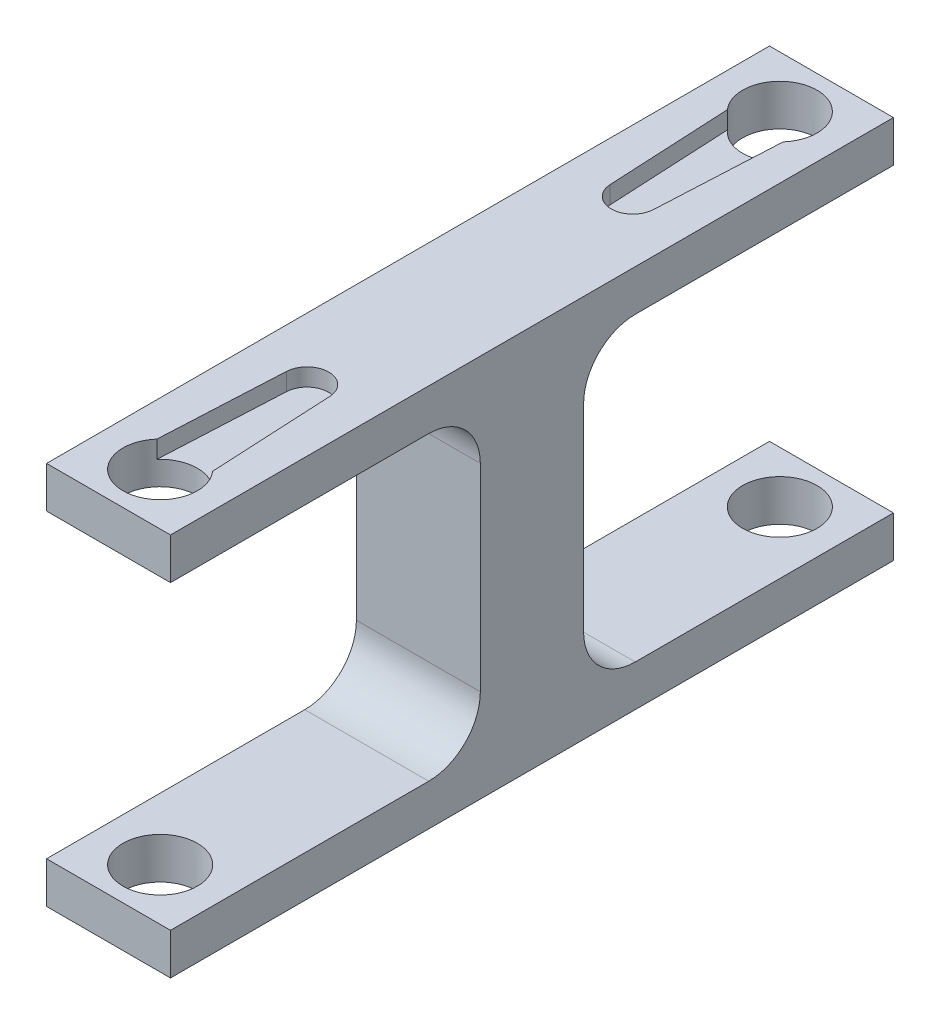
from build123d import *

# Parameters (mm, degrees)
SKETCH2_W            = 12
SKETCH2_H            = 37.15
BOSS_EXTRUDE2_DEPTH  = 2.5
SKETCH11_W           = 12
SKETCH11_H           = 4
BOSS_EXTRUDE8_DEPTH  = 30
CUT_EXTRUDE1_DEPTH   = 1.7
SKETCH14_W           = 12
SKETCH14_H           = 37.15
BOSS_EXTRUDE9_DEPTH  = 7.5
SKETCH16_W           = 12
SKETCH16_H           = 4
BOSS_EXTRUDE11_DEPTH = 30
CUT_EXTRUDE4_DEPTH   = 1.7
SKETCH22_R           = 3.6
CUT_EXTRUDE6_DEPTH   = 54.483943136
SKETCH23_R           = 3.6
CUT_EXTRUDE7_DEPTH   = 54.483943136
FILLET1_R            = 5
FILLET2_R            = 5
FILLET3_R            = 5
FILLET4_R            = 5


with BuildPart() as part:
    # Sketch2 → Boss-Extrude2 (new body)
    with BuildSketch(Plane.XY):
        with Locations((-2.61160109, -17.608451256)):
            Rectangle(SKETCH2_W, SKETCH2_H)
    extrude(amount=BOSS_EXTRUDE2_DEPTH)

    # Sketch11 → Boss-Extrude8 (add)
    with BuildSketch(Plane.XY.offset(2.5)):
        with Locations((-2.61160109, -1.033451256)):
            Rectangle(SKETCH11_W, SKETCH11_H)
        with Locations((-2.61160109, -34.183451256)):
            Rectangle(SKETCH11_W, SKETCH11_H)
    extrude(amount=BOSS_EXTRUDE8_DEPTH)

    # Sketch12 → Cut-Extrude1 (cut)
    with BuildSketch(Plane(origin=(0, 0.966548744, 0), x_dir=(1, 0, 0), z_dir=(0, 1, 0))):
        with BuildLine():
            Line((-0.514266567, -13.168774056), (0.08839891, -25.11882382))
            ThreePointArc((0.08839891, -25.11882382), (-2.61160109, -31.1), (-5.31160109, -25.11882382))
            Line((-5.31160109, -25.11882382), (-4.708935612, -13.168774056))
            ThreePointArc((-4.708935612, -13.168774056), (-2.61160109, -11.174546931), (-0.514266567, -13.168774056))
        make_face()
    extrude(amount=-CUT_EXTRUDE1_DEPTH, mode=Mode.SUBTRACT)

    # Sketch14 → Boss-Extrude9 (add)
    with BuildSketch(Plane(origin=(0, 0, 0), x_dir=(-1, 0, 0), z_dir=(0, 0, -1))):
        with Locations((2.61160109, -17.608451256)):
            Rectangle(SKETCH14_W, SKETCH14_H)
    extrude(amount=BOSS_EXTRUDE9_DEPTH)

    # Sketch16 → Boss-Extrude11 (add)
    with BuildSketch(Plane(origin=(0, 0, -7.5), x_dir=(-1, 0, 0), z_dir=(0, 0, -1))):
        with Locations((2.61160109, -1.033451256)):
            Rectangle(SKETCH16_W, SKETCH16_H)
        with Locations((2.61160109, -34.183451256)):
            Rectangle(SKETCH16_W, SKETCH16_H)
    extrude(amount=BOSS_EXTRUDE11_DEPTH)

    # Sketch20 → Cut-Extrude4 (cut)
    with BuildSketch(Plane(origin=(0, 0.966548744, 0), x_dir=(1, 0, 0), z_dir=(0, 1, 0))):
        with BuildLine():
            Line((-4.708935612, 18.168774056), (-5.31160109, 30.11882382))
            ThreePointArc((-5.31160109, 30.11882382), (-2.61160109, 36.1), (0.08839891, 30.11882382))
            Line((0.08839891, 30.11882382), (-0.514266567, 18.168774056))
            ThreePointArc((-0.514266567, 18.168774056), (-2.61160109, 16.174546931), (-4.708935612, 18.168774056))
        make_face()
    extrude(amount=-CUT_EXTRUDE4_DEPTH, mode=Mode.SUBTRACT)

    # Sketch22 → Cut-Extrude6 (cut, through all)
    with BuildSketch(Plane(origin=(0, 0.966548744, 0), x_dir=(1, 0, 0), z_dir=(0, 1, 0))):
        with Locations(Location((-2.61160109, -27.5, 0), (0, 0, 270))):
            Circle(SKETCH22_R)
    extrude(amount=-CUT_EXTRUDE6_DEPTH, mode=Mode.SUBTRACT)

    # Sketch23 → Cut-Extrude7 (cut, through all)
    with BuildSketch(Plane(origin=(0, 0.966548744, 0), x_dir=(1, 0, 0), z_dir=(0, 1, 0))):
        with Locations(Location((-2.61160109, 32.5, 0), (0, 0, 221.409622109))):
            Circle(SKETCH23_R)
    extrude(amount=-CUT_EXTRUDE7_DEPTH, mode=Mode.SUBTRACT)

    # Fillet1
    fillet1_edges = [part.edges().sort_by_distance(p)[0] for p in [
        (-2.61160109, -3.033451256, 2.5),
    ]]
    fillet(fillet1_edges, radius=FILLET1_R)

    # Fillet2
    fillet2_edges = [part.edges().sort_by_distance(p)[0] for p in [
        (-2.61160109, -32.183451256, 2.5),
    ]]
    fillet(fillet2_edges, radius=FILLET2_R)

    # Fillet3
    fillet3_edges = [part.edges().sort_by_distance(p)[0] for p in [
        (-2.61160109, -3.033451256, -7.5),
    ]]
    fillet(fillet3_edges, radius=FILLET3_R)

    # Fillet4
    fillet4_edges = [part.edges().sort_by_distance(p)[0] for p in [
        (-2.61160109, -32.183451256, -7.5),
    ]]
    fillet(fillet4_edges, radius=FILLET4_R)


solid = part.part
